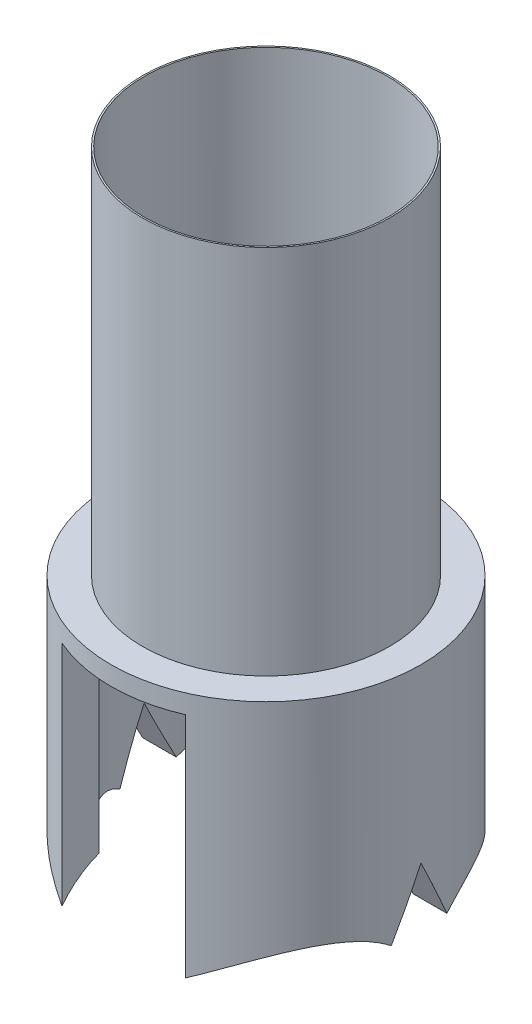
from build123d import *

# Parameters (mm, degrees)
SKETCH1_R           = 1.9939
BOSS_EXTRUDE1_DEPTH = 5.9944
SKETCH2_R           = 2.5019
BOSS_EXTRUDE2_DEPTH = 3.9878
SKETCH3_R           = 1.9685
CUT_EXTRUDE1_DEPTH  = 11.59071877
SKETCH4_W           = 1.99898
SKETCH4_H           = 3.683
CUT_EXTRUDE2_DEPTH  = 9.199411528
CUT_EXTRUDE3_REACH  = 10.199
CUT_EXTRUDE4_REACH  = 10.199


with BuildPart() as part:
    # Sketch1 → Boss-Extrude1 (new body)
    with BuildSketch(Plane(origin=(0, 0, 0), x_dir=(1, 0, 0), z_dir=(0, 1, 0))):
        with Locations(Location((0, 0, 0), (0, 0, 90))):
            Circle(SKETCH1_R)
    extrude(amount=BOSS_EXTRUDE1_DEPTH)

    # Sketch2 → Boss-Extrude2 (add)
    with BuildSketch(Plane(origin=(0, 0, 0), x_dir=(1, 0, 0), z_dir=(0, 1, 0))):
        with Locations(Location((0, 0, 0), (0, 0, 270))):
            Circle(SKETCH2_R)
    extrude(amount=-BOSS_EXTRUDE2_DEPTH)

    # Sketch3 → Cut-Extrude1 (cut, through all)
    with BuildSketch(Plane(origin=(0, 5.9944, 0), x_dir=(1, 0, 0), z_dir=(0, 1, 0))):
        with Locations(Location((0, 0, 0), (0, 0, 270))):
            Circle(SKETCH3_R)
    extrude(amount=-CUT_EXTRUDE1_DEPTH, mode=Mode.SUBTRACT)

    # Sketch4 → Cut-Extrude2 (cut, through all)
    with BuildSketch(Plane.XY.offset(2.5019)):
        with Locations((-0.00381, -2.1463)):
            Rectangle(SKETCH4_W, SKETCH4_H)
    extrude(amount=-CUT_EXTRUDE2_DEPTH, mode=Mode.SUBTRACT)

    # Sketch6 → Cut-Extrude3 (cut, up to next)
    with BuildSketch(Plane(origin=(-2.5019, 0, 0), x_dir=(0, 0, -1), z_dir=(1, 0, 0)), mode=Mode.PRIVATE) as cut_extrude3_sk1:
        with BuildLine():
            Line((-2.295239627, -3.9878), (2.295239627, -3.9878))
            ThreePointArc((2.295239627, -3.9878), (1.432460388, -3.48008017), (0.463371203, -3.731145085))
            Line((0.463371203, -3.731145085), (0, -2.771398111))
            Line((0, -2.771398111), (-0.439998736, -3.731145085))
            ThreePointArc((-0.439998736, -3.731145085), (-1.420774155, -3.475239573), (-2.295239627, -3.9878))
        make_face()
    cut_extrude3_tool1 = extrude(cut_extrude3_sk1.sketch, amount=CUT_EXTRUDE3_REACH, mode=Mode.PRIVATE) & part.part
    add(cut_extrude3_tool1.solids().sort_by_distance((-2.5019, -3.705676, 0.002257))[0], mode=Mode.SUBTRACT)

    # Sketch5 → Cut-Extrude4 (cut, up to next)
    with BuildSketch(Plane(origin=(2.5019, 0, 0), x_dir=(0, 0, -1), z_dir=(1, 0, 0)), mode=Mode.PRIVATE) as cut_extrude4_sk1:
        with BuildLine():
            Line((0.463371203, -3.731145085), (0, -2.771398111))
            Line((0, -2.771398111), (-0.439998736, -3.731145085))
            ThreePointArc((-0.439998736, -3.731145085), (-1.420774155, -3.475239573), (-2.295239627, -3.9878))
            Line((-2.295239627, -3.9878), (2.295239627, -3.9878))
            ThreePointArc((2.295239627, -3.9878), (1.432460388, -3.48008017), (0.463371203, -3.731145085))
        make_face()
    cut_extrude4_tool1 = extrude(cut_extrude4_sk1.sketch, amount=-CUT_EXTRUDE4_REACH, mode=Mode.PRIVATE) & part.part
    add(cut_extrude4_tool1.solids().sort_by_distance((2.5019, -3.705676, 0.002257))[0], mode=Mode.SUBTRACT)


solid = part.part
